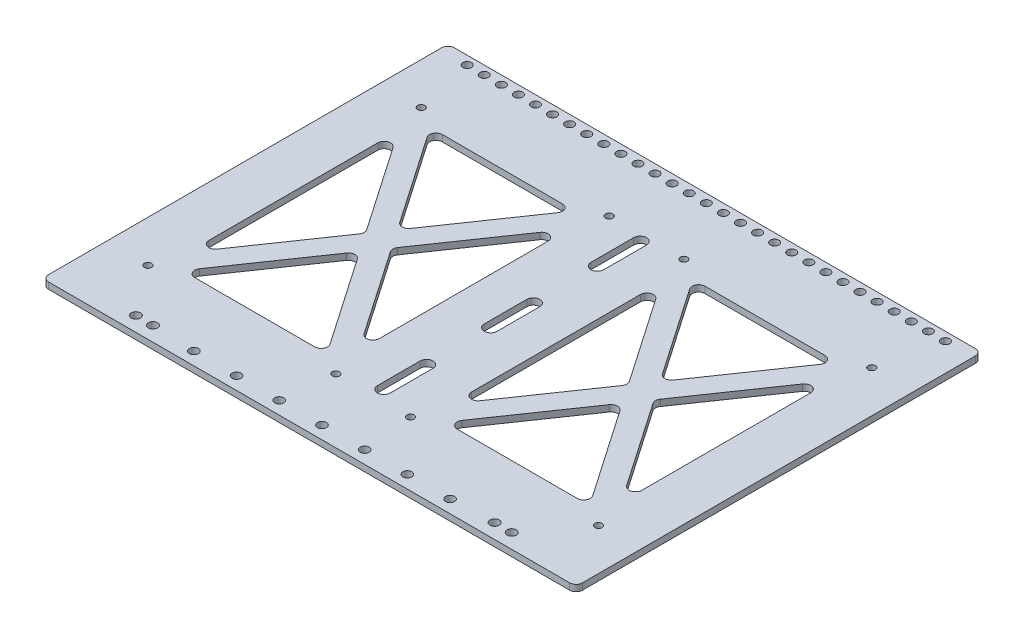
from build123d import *

# Parameters (mm, degrees)
SKETCH_1_W               = 250
SKETCH_1_H               = 190
EXTRUDE_1_DEPTH          = 3
CUT_EXTRUDE_1_DEPTH      = 158.031843904
CUT_EXTRUDE_1_DEPTH_BACK = 158.031843904
SKETCH_3_R               = 2.15
CUT_EXTRUDE_2_DEPTH      = 158.031843904
SKETCH_4_R               = 2.1
CUT_EXTRUDE_3_DEPTH      = 158.031843904
CUT_EXTRUDE_4_DEPTH      = 158.031843904
FILLET_1_R               = 3
CUT_EXTRUDE_5_DEPTH      = 158.031843904


with BuildPart() as part:
    # 草图1 → 凸台-拉伸1 (new body)
    with BuildSketch(Plane(origin=(0, 0, 0), x_dir=(1, 0, 0), z_dir=(0, 1, 0))):
        Rectangle(SKETCH_1_W, SKETCH_1_H)
    extrude(amount=EXTRUDE_1_DEPTH)

    # 草图2 → 切除-拉伸1 (cut, two sides: drawn at the far end of the back side and taken through both)
    with BuildSketch(Plane.XZ.offset(-CUT_EXTRUDE_1_DEPTH_BACK)):
        with BuildLine():
            ThreePointArc((56, -93), (58, -91), (56, -89))
            ThreePointArc((56, -89), (54, -91), (56, -93))
        make_face()
        with BuildLine():
            ThreePointArc((-112, -93), (-110, -91), (-112, -89))
            ThreePointArc((-112, -89), (-114, -91), (-112, -93))
        make_face()
        with BuildLine():
            ThreePointArc((-104, -93), (-102, -91), (-104, -89))
            ThreePointArc((-104, -89), (-106, -91), (-104, -93))
        make_face()
        with BuildLine():
            ThreePointArc((-96, -93), (-94, -91), (-96, -89))
            ThreePointArc((-96, -89), (-98, -91), (-96, -93))
        make_face()
        with BuildLine():
            ThreePointArc((-88, -93), (-86, -91), (-88, -89))
            ThreePointArc((-88, -89), (-90, -91), (-88, -93))
        make_face()
        with BuildLine():
            ThreePointArc((-48, -93), (-46, -91), (-48, -89))
            ThreePointArc((-48, -89), (-50, -91), (-48, -93))
        make_face()
        with BuildLine():
            ThreePointArc((-80, -93), (-78, -91), (-80, -89))
            ThreePointArc((-80, -89), (-82, -91), (-80, -93))
        make_face()
        with BuildLine():
            ThreePointArc((-72, -93), (-70, -91), (-72, -89))
            ThreePointArc((-72, -89), (-74, -91), (-72, -93))
        make_face()
        with BuildLine():
            ThreePointArc((-64, -93), (-62, -91), (-64, -89))
            ThreePointArc((-64, -89), (-66, -91), (-64, -93))
        make_face()
        with BuildLine():
            ThreePointArc((-56, -93), (-54, -91), (-56, -89))
            ThreePointArc((-56, -89), (-58, -91), (-56, -93))
        make_face()
        with BuildLine():
            ThreePointArc((64, -93), (66, -91), (64, -89))
            ThreePointArc((64, -89), (62, -91), (64, -93))
        make_face()
        with BuildLine():
            ThreePointArc((72, -93), (74, -91), (72, -89))
            ThreePointArc((72, -89), (70, -91), (72, -93))
        make_face()
        with BuildLine():
            ThreePointArc((80, -93), (82, -91), (80, -89))
            ThreePointArc((80, -89), (78, -91), (80, -93))
        make_face()
        with BuildLine():
            ThreePointArc((88, -93), (90, -91), (88, -89))
            ThreePointArc((88, -89), (86, -91), (88, -93))
        make_face()
        with BuildLine():
            ThreePointArc((96, -93), (98, -91), (96, -89))
            ThreePointArc((96, -89), (94, -91), (96, -93))
        make_face()
        with BuildLine():
            ThreePointArc((104, -93), (106, -91), (104, -89))
            ThreePointArc((104, -89), (102, -91), (104, -93))
        make_face()
        with BuildLine():
            ThreePointArc((112, -93), (114, -91), (112, -89))
            ThreePointArc((112, -89), (110, -91), (112, -93))
        make_face()
        with BuildLine():
            ThreePointArc((32, -93), (34, -91), (32, -89))
            ThreePointArc((32, -89), (30, -91), (32, -93))
        make_face()
        with BuildLine():
            ThreePointArc((24, -93), (26, -91), (24, -89))
            ThreePointArc((24, -89), (22, -91), (24, -93))
        make_face()
        with BuildLine():
            ThreePointArc((16, -93), (18, -91), (16, -89))
            ThreePointArc((16, -89), (14, -91), (16, -93))
        make_face()
        with BuildLine():
            ThreePointArc((8, -93), (10, -91), (8, -89))
            ThreePointArc((8, -89), (6, -91), (8, -93))
        make_face()
        with BuildLine():
            ThreePointArc((0, -93), (2, -91), (0, -89))
            ThreePointArc((0, -89), (-2, -91), (0, -93))
        make_face()
        with BuildLine():
            ThreePointArc((-8, -93), (-6, -91), (-8, -89))
            ThreePointArc((-8, -89), (-10, -91), (-8, -93))
        make_face()
        with BuildLine():
            ThreePointArc((-16, -93), (-14, -91), (-16, -89))
            ThreePointArc((-16, -89), (-18, -91), (-16, -93))
        make_face()
        with BuildLine():
            ThreePointArc((-24, -93), (-22, -91), (-24, -89))
            ThreePointArc((-24, -89), (-26, -91), (-24, -93))
        make_face()
        with BuildLine():
            ThreePointArc((-32, -93), (-30, -91), (-32, -89))
            ThreePointArc((-32, -89), (-34, -91), (-32, -93))
        make_face()
        with BuildLine():
            ThreePointArc((-40, -93), (-38, -91), (-40, -89))
            ThreePointArc((-40, -89), (-42, -91), (-40, -93))
        make_face()
        with BuildLine():
            ThreePointArc((40, -93), (42, -91), (40, -89))
            ThreePointArc((40, -89), (38, -91), (40, -93))
        make_face()
        with BuildLine():
            ThreePointArc((48, -93), (50, -91), (48, -89))
            ThreePointArc((48, -89), (46, -91), (48, -93))
        make_face()
    extrude(amount=CUT_EXTRUDE_1_DEPTH + CUT_EXTRUDE_1_DEPTH_BACK, mode=Mode.SUBTRACT)

    # 草图3 → 切除-拉伸2 (cut, through all)
    with BuildSketch(Plane(origin=(0, 3, 0), x_dir=(1, 0, 0), z_dir=(0, 1, 0))):
        with Locations(Location((80, -88.135135135, 0), (0, 0, 270))):
            Circle(SKETCH_3_R)
        with Locations(Location((88, -88.135135135, 0), (0, 0, 270))):
            Circle(SKETCH_3_R)
        with Locations(Location((-80, -88.135135135, 0), (0, 0, 270))):
            Circle(SKETCH_3_R)
        with Locations(Location((-88, -88.135135135, 0), (0, 0, 270))):
            Circle(SKETCH_3_R)
        with BuildLine():
            ThreePointArc((105.5, -66.7), (107.2, -65), (105.5, -63.3))
            ThreePointArc((105.5, -63.3), (103.8, -65), (105.5, -66.7))
        make_face()
        with BuildLine():
            ThreePointArc((17.5, -63.3), (15.8, -65), (17.5, -66.7))
            ThreePointArc((17.5, -66.7), (19.2, -65), (17.5, -63.3))
        make_face()
        with BuildLine():
            ThreePointArc((-17.5, -63.3), (-19.2, -65), (-17.5, -66.7))
            ThreePointArc((-17.5, -66.7), (-15.8, -65), (-17.5, -63.3))
        make_face()
        with BuildLine():
            ThreePointArc((-105.5, -66.7), (-103.8, -65), (-105.5, -63.3))
            ThreePointArc((-105.5, -63.3), (-107.2, -65), (-105.5, -66.7))
        make_face()
        with BuildLine():
            ThreePointArc((105.5, 61.3), (107.2, 63), (105.5, 64.7))
            ThreePointArc((105.5, 64.7), (103.8, 63), (105.5, 61.3))
        make_face()
        with BuildLine():
            ThreePointArc((17.5, 64.7), (15.8, 63), (17.5, 61.3))
            ThreePointArc((17.5, 61.3), (19.2, 63), (17.5, 64.7))
        make_face()
        with BuildLine():
            ThreePointArc((-17.5, 61.3), (-15.8, 63), (-17.5, 64.7))
            ThreePointArc((-17.5, 64.7), (-19.2, 63), (-17.5, 61.3))
        make_face()
        with BuildLine():
            ThreePointArc((-105.5, 64.7), (-107.2, 63), (-105.5, 61.3))
            ThreePointArc((-105.5, 61.3), (-103.8, 63), (-105.5, 64.7))
        make_face()
    extrude(amount=-CUT_EXTRUDE_2_DEPTH, mode=Mode.SUBTRACT)

    # 草图4 → 切除-拉伸3 (cut, through all)
    with BuildSketch(Plane(origin=(0, 3, 0), x_dir=(1, 0, 0), z_dir=(0, 1, 0))):
        with Locations(Location((0, -89, 0), (0, 0, 270))):
            Circle(SKETCH_4_R)
        with Locations(Location((20, -89, 0), (0, 0, 270))):
            Circle(SKETCH_4_R)
        with Locations(Location((40, -89, 0), (0, 0, 270))):
            Circle(SKETCH_4_R)
        with Locations(Location((60, -89, 0), (0, 0, 270))):
            Circle(SKETCH_4_R)
        with Locations(Location((-60, -89, 0), (0, 0, 90))):
            Circle(SKETCH_4_R)
        with Locations(Location((-40, -89, 0), (0, 0, 90))):
            Circle(SKETCH_4_R)
        with Locations(Location((-20, -89, 0), (0, 0, 90))):
            Circle(SKETCH_4_R)
    extrude(amount=-CUT_EXTRUDE_3_DEPTH, mode=Mode.SUBTRACT)

    # 草图5 → 切除-拉伸4 (cut, through all)
    with BuildSketch(Plane(origin=(0, 3, 0), x_dir=(1, 0, 0), z_dir=(0, 1, 0))):
        Polygon((-95.30734755, 57), (-61.5, 7.82567629), (-27.69265245, 57), align=None)
        Polygon((-101.375, -50.17432371), (-67.56765245, -1), (-101.375, 48.17432371), align=None)
        Polygon((-95.30734755, -59), (-27.69265245, -59), (-61.5, -9.82567629), align=None)
        Polygon((-55.43234755, -1), (-21.625, -50.17432371), (-21.625, 48.17432371), align=None)
        Polygon((21.625, -50.17432371), (55.43234755, -1), (21.625, 48.17432371), align=None)
        Polygon((61.5, 7.82567629), (95.30734755, 57), (27.69265245, 57), align=None)
        Polygon((101.375, 48.17432371), (67.56765245, -1), (101.375, -50.17432371), align=None)
        Polygon((95.30734755, -59), (61.5, -9.82567629), (27.69265245, -59), align=None)
    extrude(amount=-CUT_EXTRUDE_4_DEPTH, mode=Mode.SUBTRACT)

    # 圆角1
    fillet_1_edges = [part.edges().sort_by_distance(p)[0] for p in [
        (21.625, 1.5, 50.17432371),
        (21.625, 1.5, -48.17432371),
        (55.43234755, 1.5, 1),
        (-55.43234755, 1.5, 1),
        (-21.625, 1.5, -48.17432371),
        (-21.625, 1.5, 50.17432371),
        (-101.375, 1.5, -48.17432371),
        (-67.56765245, 1.5, 1),
        (-101.375, 1.5, 50.17432371),
        (-61.5, 1.5, 9.82567629),
        (-27.69265245, 1.5, 59),
        (-95.30734755, 1.5, 59),
        (27.69265245, 1.5, 59),
        (61.5, 1.5, 9.82567629),
        (95.30734755, 1.5, 59),
        (27.69265245, 1.5, -57),
        (95.30734755, 1.5, -57),
        (61.5, 1.5, -7.82567629),
        (101.375, 1.5, 50.17432371),
        (67.56765245, 1.5, 1),
        (101.375, 1.5, -48.17432371),
        (-95.30734755, 1.5, -57),
        (-27.69265245, 1.5, -57),
        (-61.5, 1.5, -7.82567629),
        (-125, 1.5, -95),
        (-125, 1.5, 95),
        (125, 1.5, 95),
        (125, 1.5, -95),
    ]]
    fillet(fillet_1_edges, radius=FILLET_1_R)

    # 草图6 → 切除-拉伸5 (cut, through all)
    with BuildSketch(Plane(origin=(0, 3, 0), x_dir=(1, 0, 0), z_dir=(0, 1, 0))):
        with BuildLine():
            Line((-3, -10), (-3, 10))
            ThreePointArc((-3, 10), (0, 13), (3, 10))
            Line((3, 10), (3, -10))
            ThreePointArc((3, -10), (0, -13), (-3, -10))
        make_face()
        with BuildLine():
            Line((3, 40), (3, 60))
            ThreePointArc((3, 60), (0, 63), (-3, 60))
            Line((-3, 60), (-3, 40))
            ThreePointArc((-3, 40), (0, 37), (3, 40))
        make_face()
        with BuildLine():
            Line((3, -60), (3, -40))
            ThreePointArc((3, -40), (0, -37), (-3, -40))
            Line((-3, -40), (-3, -60))
            ThreePointArc((-3, -60), (0, -63), (3, -60))
        make_face()
    extrude(amount=-CUT_EXTRUDE_5_DEPTH, mode=Mode.SUBTRACT)


solid = part.part
